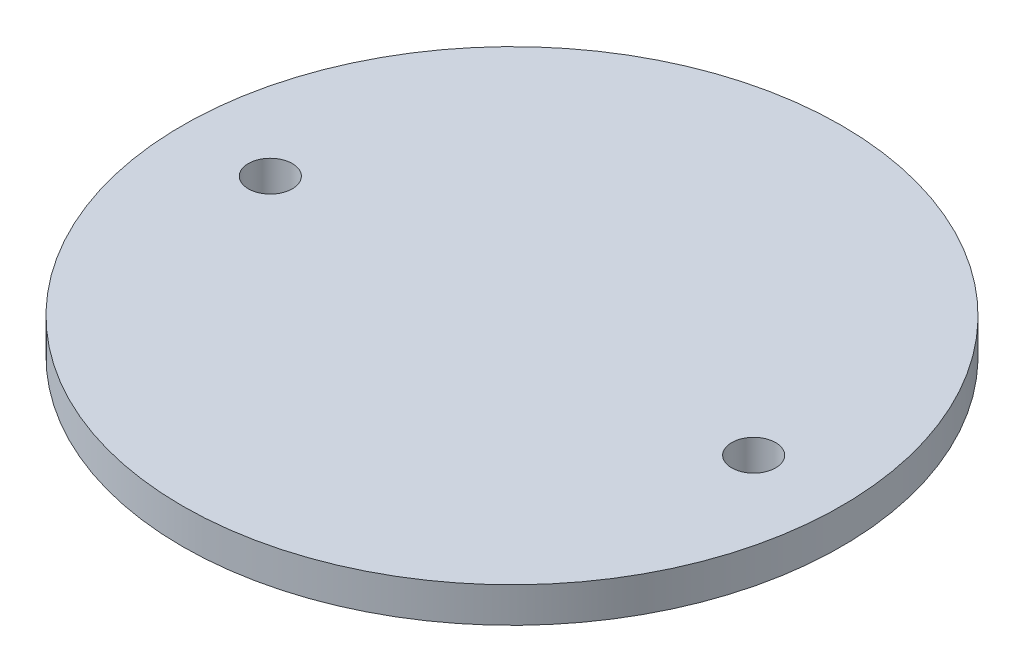
from build123d import *

# Parameters (mm, degrees)
SKETCH1_R           = 37.5
BOSS_EXTRUDE1_DEPTH = 4
SKETCH2_R           = 2.5
CUT_EXTRUDE1_DEPTH  = 54.183644102


with BuildPart() as part:
    # Sketch1 → Boss-Extrude1 (new body)
    with BuildSketch(Plane(origin=(0, 0, 0), x_dir=(1, 0, 0), z_dir=(0, 1, 0))):
        with Locations(Location((0, 0, 0), (0, 0, 270))):
            Circle(SKETCH1_R)
    extrude(amount=BOSS_EXTRUDE1_DEPTH)

    # Sketch2 → Cut-Extrude1 (cut, through all)
    with BuildSketch(Plane(origin=(0, 4, 0), x_dir=(1, 0, 0), z_dir=(0, 1, 0))):
        with Locations(Location((-27.5, 0, 0), (0, 0, 270))):
            Circle(SKETCH2_R)
        with Locations(Location((27.5, 0, 0), (0, 0, 270))):
            Circle(SKETCH2_R)
    extrude(amount=-CUT_EXTRUDE1_DEPTH, mode=Mode.SUBTRACT)


solid = part.part
